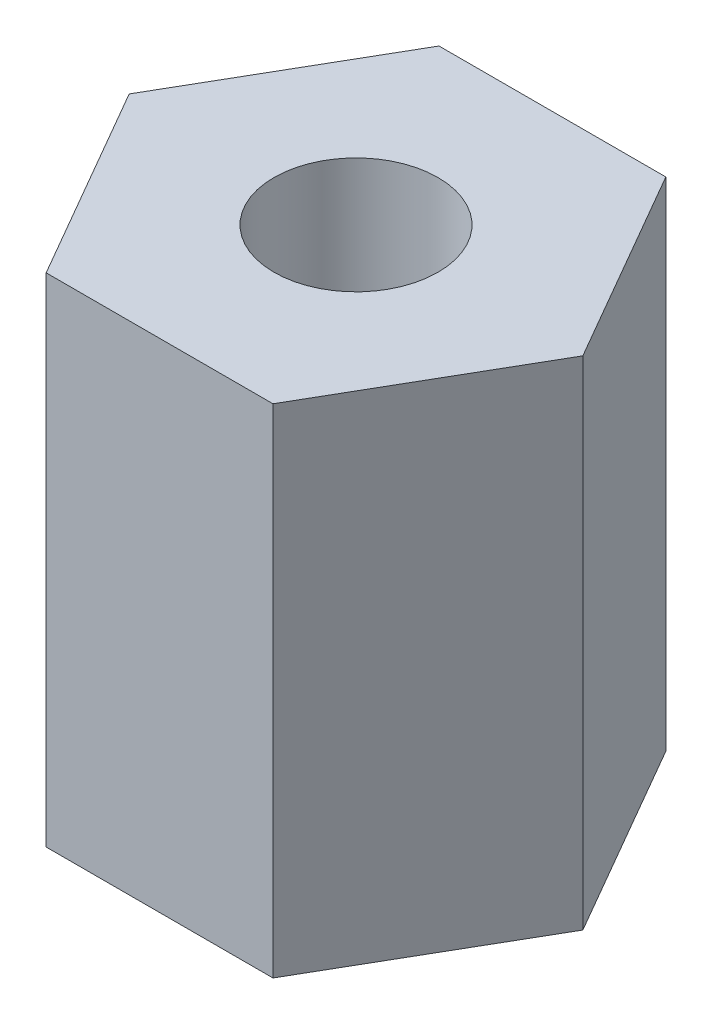
from build123d import *

# Parameters (mm, degrees)
BOSS_EXTRUDE1_DEPTH = 10
CUT_EXTRUDE6_DEPTH  = 14
SKETCH11_R          = 1.65
CUT_EXTRUDE7_DEPTH  = 3


with BuildPart() as part:
    # Sketch1 → Boss-Extrude1 (new body)
    with BuildSketch(Plane(origin=(0, 0, 0), x_dir=(1, 0, 0), z_dir=(0, 1, 0))):
        Polygon((4.561067127, 0), (2.280533563, 3.95), (-2.280533563, 3.95), (-4.561067127, 0), (-2.280533563, -3.95), (2.280533563, -3.95), align=None)
    extrude(amount=BOSS_EXTRUDE1_DEPTH)

    # Sketch9 → Cut-Extrude6 (cut)
    with BuildSketch(Plane(origin=(0, 10, 0), x_dir=(1, 0, 0), z_dir=(0, 1, 0))):
        with BuildLine():
            Line((-1.217575979, -1.113556795), (1.217575979, -1.113556795))
            ThreePointArc((1.217575979, -1.113556795), (0, 1.65), (-1.217575979, -1.113556795))
        make_face()
    extrude(amount=-CUT_EXTRUDE6_DEPTH, mode=Mode.SUBTRACT)

    # Sketch11 → Cut-Extrude7 (cut)
    with BuildSketch(Plane(origin=(0, 10, 0), x_dir=(1, 0, 0), z_dir=(0, 1, 0))):
        with Locations(Location((0, 0, 0), (0, 0, 317.554942162))):
            Circle(SKETCH11_R)
    extrude(amount=-CUT_EXTRUDE7_DEPTH, mode=Mode.SUBTRACT)


solid = part.part
